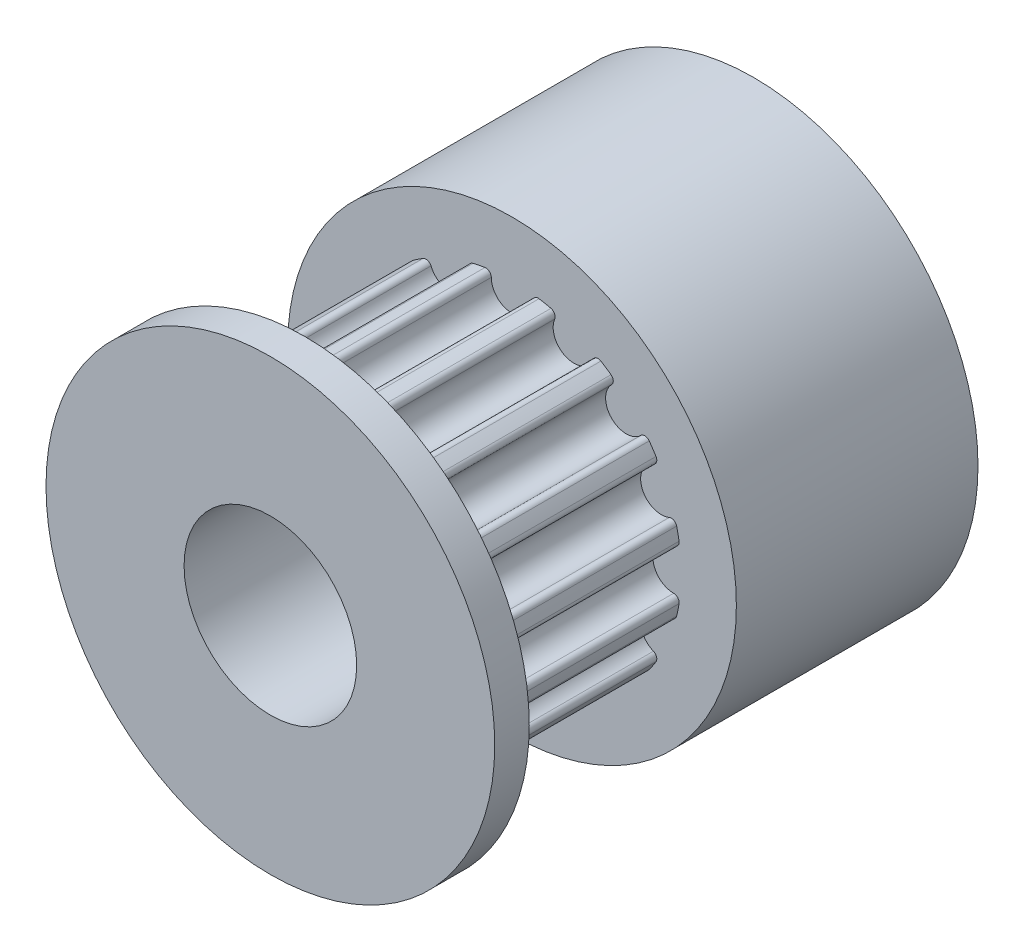
from build123d import *

# Parameters (mm, degrees)
SKETCH_1_R          = 6.5
EXTRUDE_1_DEPTH     = 7
EXTRUDE_2_DEPTH     = 6
SKETCH_4_R          = 6.5
EXTRUDE_3_DEPTH     = 1
SKETCH_5_R          = 2.5
CUT_EXTRUDE_1_DEPTH = 17.748134224


with BuildPart() as part:
    # 草图1 → 凸台-拉伸1 (new body)
    with BuildSketch(Plane.XY):
        Circle(SKETCH_1_R)
    extrude(amount=EXTRUDE_1_DEPTH)

    # 草图2 → 凸台-拉伸2 (add)
    with BuildSketch(Plane.XY.offset(7)):
        with BuildLine():
            ThreePointArc((-0.599999991, 4.683458109), (-0.655607945, 4.803813062), (-0.783301597, 4.839476633))
            ThreePointArc((-0.783301597, 4.839476633), (-0.95642213, 4.808258747), (-1.128311215, 4.770849953))
            ThreePointArc((-1.128311215, 4.770849953), (-1.232636909, 4.689034864), (-1.237954113, 4.556561144))
            ThreePointArc((-1.237954113, 4.556561144), (-1.562671768, 3.772623377), (-2.346609536, 4.097341032))
            ThreePointArc((-2.346609536, 4.097341032), (-2.444042432, 4.187254267), (-2.575663842, 4.171336866))
            ThreePointArc((-2.575663842, 4.171336866), (-2.723659792, 4.07624494), (-2.868148874, 3.975904616))
            ThreePointArc((-2.868148874, 3.975904616), (-2.933223968, 3.860393615), (-2.887440926, 3.73596905))
            ThreePointArc((-2.887440926, 3.73596905), (-2.887440926, 2.887440926), (-3.73596905, 2.887440926))
            ThreePointArc((-3.73596905, 2.887440926), (-3.860393615, 2.933223968), (-3.975904616, 2.868148874))
            ThreePointArc((-3.975904616, 2.868148874), (-4.07624494, 2.723659792), (-4.171336866, 2.575663842))
            ThreePointArc((-4.171336866, 2.575663842), (-4.187254267, 2.444042432), (-4.097341032, 2.346609535))
            ThreePointArc((-4.097341032, 2.346609535), (-3.772623377, 1.562671768), (-4.556561144, 1.237954113))
            ThreePointArc((-4.556561144, 1.237954113), (-4.689034864, 1.232636909), (-4.770849953, 1.128311215))
            ThreePointArc((-4.770849953, 1.128311215), (-4.808258747, 0.95642213), (-4.839476633, 0.783301597))
            ThreePointArc((-4.839476633, 0.783301597), (-4.803813062, 0.655607945), (-4.683458109, 0.599999991))
            ThreePointArc((-4.683458109, 0.599999991), (-4.083458118, 0), (-4.683458109, -0.599999991))
            ThreePointArc((-4.683458109, -0.599999991), (-4.803813062, -0.655607945), (-4.839476633, -0.783301597))
            ThreePointArc((-4.839476633, -0.783301597), (-4.808258747, -0.95642213), (-4.770849953, -1.128311215))
            ThreePointArc((-4.770849953, -1.128311215), (-4.689034864, -1.232636909), (-4.556561144, -1.237954113))
            ThreePointArc((-4.556561144, -1.237954113), (-3.772623377, -1.562671768), (-4.097341032, -2.346609536))
            ThreePointArc((-4.097341032, -2.346609536), (-4.187254267, -2.444042432), (-4.171336866, -2.575663842))
            ThreePointArc((-4.171336866, -2.575663842), (-4.07624494, -2.723659792), (-3.975904616, -2.868148874))
            ThreePointArc((-3.975904616, -2.868148874), (-3.860393615, -2.933223968), (-3.73596905, -2.887440926))
            ThreePointArc((-3.73596905, -2.887440926), (-2.887440926, -2.887440926), (-2.887440926, -3.73596905))
            ThreePointArc((-2.887440926, -3.73596905), (-2.933223968, -3.860393615), (-2.868148874, -3.975904616))
            ThreePointArc((-2.868148874, -3.975904616), (-2.723659792, -4.07624494), (-2.575663842, -4.171336866))
            ThreePointArc((-2.575663842, -4.171336866), (-2.444042432, -4.187254267), (-2.346609535, -4.097341032))
            ThreePointArc((-2.346609535, -4.097341032), (-1.562671768, -3.772623377), (-1.237954113, -4.556561144))
            ThreePointArc((-1.237954113, -4.556561144), (-1.232636909, -4.689034864), (-1.128311215, -4.770849953))
            ThreePointArc((-1.128311215, -4.770849953), (-0.95642213, -4.808258747), (-0.783301597, -4.839476633))
            ThreePointArc((-0.783301597, -4.839476633), (-0.655607945, -4.803813062), (-0.599999991, -4.683458109))
            ThreePointArc((-0.599999991, -4.683458109), (0, -4.083458118), (0.599999991, -4.683458109))
            ThreePointArc((0.599999991, -4.683458109), (0.655607945, -4.803813062), (0.783301597, -4.839476633))
            ThreePointArc((0.783301597, -4.839476633), (0.95642213, -4.808258747), (1.128311215, -4.770849953))
            ThreePointArc((1.128311215, -4.770849953), (1.232636909, -4.689034864), (1.237954113, -4.556561144))
            ThreePointArc((1.237954113, -4.556561144), (1.562671768, -3.772623377), (2.346609536, -4.097341032))
            ThreePointArc((2.346609536, -4.097341032), (2.444042432, -4.187254267), (2.575663842, -4.171336866))
            ThreePointArc((2.575663842, -4.171336866), (2.723659792, -4.07624494), (2.868148874, -3.975904616))
            ThreePointArc((2.868148874, -3.975904616), (2.933223968, -3.860393615), (2.887440926, -3.73596905))
            ThreePointArc((2.887440926, -3.73596905), (2.887440926, -2.887440926), (3.73596905, -2.887440926))
            ThreePointArc((3.73596905, -2.887440926), (3.860393615, -2.933223968), (3.975904616, -2.868148874))
            ThreePointArc((3.975904616, -2.868148874), (4.07624494, -2.723659792), (4.171336866, -2.575663842))
            ThreePointArc((4.171336866, -2.575663842), (4.187254267, -2.444042432), (4.097341032, -2.346609535))
            ThreePointArc((4.097341032, -2.346609535), (3.772623377, -1.562671768), (4.556561144, -1.237954113))
            ThreePointArc((4.556561144, -1.237954113), (4.689034864, -1.232636909), (4.770849953, -1.128311215))
            ThreePointArc((4.770849953, -1.128311215), (4.808258747, -0.95642213), (4.839476633, -0.783301597))
            ThreePointArc((4.839476633, -0.783301597), (4.803813062, -0.655607945), (4.683458109, -0.599999991))
            ThreePointArc((4.683458109, -0.599999991), (4.083458118, 0), (4.683458109, 0.599999991))
            ThreePointArc((4.683458109, 0.599999991), (4.803813062, 0.655607945), (4.839476633, 0.783301597))
            ThreePointArc((4.839476633, 0.783301597), (4.808258747, 0.95642213), (4.770849953, 1.128311215))
            ThreePointArc((4.770849953, 1.128311215), (4.689034864, 1.232636909), (4.556561144, 1.237954113))
            ThreePointArc((4.556561144, 1.237954113), (3.772623377, 1.562671768), (4.097341032, 2.346609536))
            ThreePointArc((4.097341032, 2.346609536), (4.187254267, 2.444042432), (4.171336866, 2.575663842))
            ThreePointArc((4.171336866, 2.575663842), (4.07624494, 2.723659792), (3.975904616, 2.868148874))
            ThreePointArc((3.975904616, 2.868148874), (3.860393615, 2.933223968), (3.73596905, 2.887440926))
            ThreePointArc((3.73596905, 2.887440926), (2.887440926, 2.887440926), (2.887440926, 3.73596905))
            ThreePointArc((2.887440926, 3.73596905), (2.933223968, 3.860393615), (2.868148874, 3.975904616))
            ThreePointArc((2.868148874, 3.975904616), (2.723659792, 4.07624494), (2.575663842, 4.171336866))
            ThreePointArc((2.575663842, 4.171336866), (2.444042432, 4.187254267), (2.346609535, 4.097341032))
            ThreePointArc((2.346609535, 4.097341032), (1.562671768, 3.772623377), (1.237954113, 4.556561144))
            ThreePointArc((1.237954113, 4.556561144), (1.232636909, 4.689034864), (1.128311215, 4.770849953))
            ThreePointArc((1.128311215, 4.770849953), (0.95642213, 4.808258747), (0.783301597, 4.839476633))
            ThreePointArc((0.783301597, 4.839476633), (0.655607945, 4.803813062), (0.599999991, 4.683458109))
            ThreePointArc((0.599999991, 4.683458109), (0, 4.083458118), (-0.599999991, 4.683458109))
        make_face()
    extrude(amount=EXTRUDE_2_DEPTH)

    # 草图4 → 凸台-拉伸3 (add)
    with BuildSketch(Plane.XY.offset(13)):
        Circle(SKETCH_4_R)
    extrude(amount=EXTRUDE_3_DEPTH)

    # 草图5 → 切除-拉伸1 (cut, through all)
    with BuildSketch(Plane(origin=(0, 0, 0), x_dir=(-1, 0, 0), z_dir=(0, 0, -1))):
        Circle(SKETCH_5_R)
    extrude(amount=-CUT_EXTRUDE_1_DEPTH, mode=Mode.SUBTRACT)


solid = part.part
